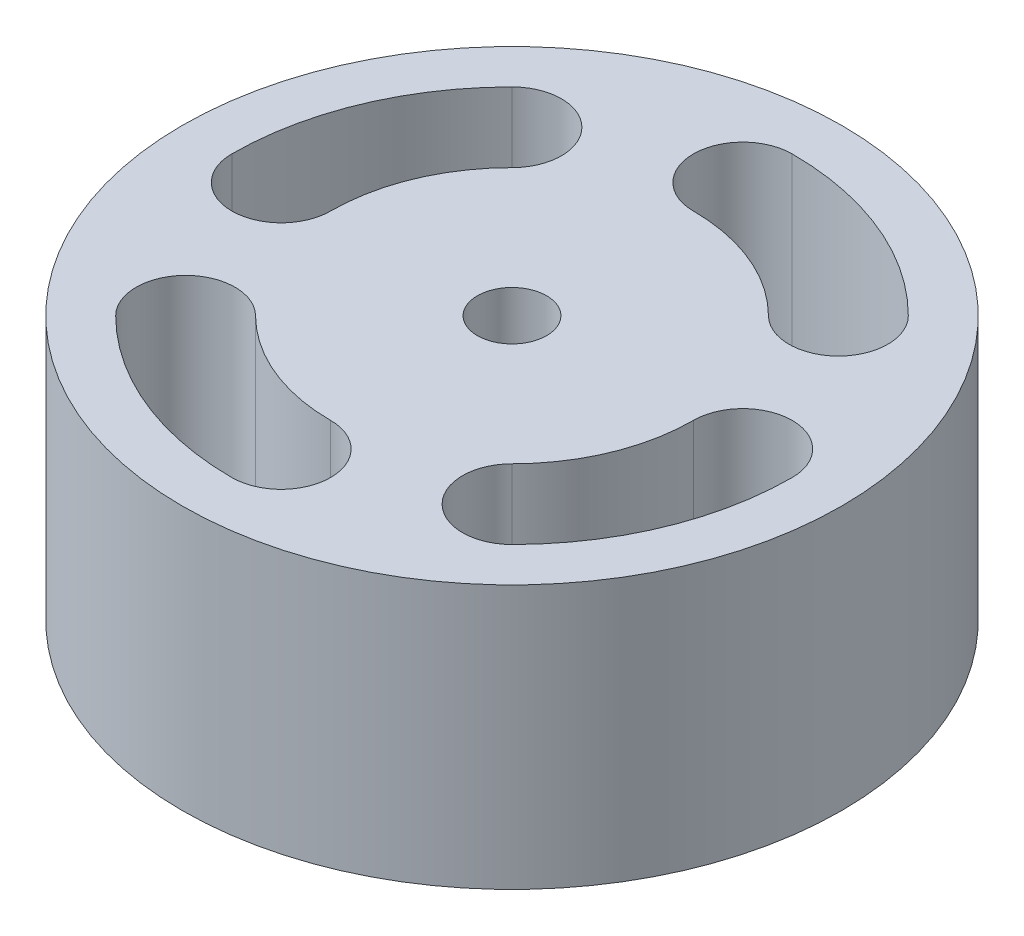
from build123d import *

# Parameters (mm, degrees)
SKETCH_1_R          = 50
EXTRUDE_1_DEPTH     = 20
SKETCH_2_R          = 5.25
CUT_EXTRUDE_1_DEPTH = 20
CUT_EXTRUDE_2_DEPTH = 20
SKETCH_4_R          = 50
SKETCH_4_R_2        = 5.25
EXTRUDE_2_DEPTH     = 20


with BuildPart() as part:
    # 草图1 → 凸台-拉伸1 (new body)
    with BuildSketch(Plane(origin=(0, 0, 0), x_dir=(1, 0, 0), z_dir=(0, 1, 0))):
        with Locations(Location((0, 0, 0), (0, 0, 270))):
            Circle(SKETCH_1_R)
    extrude(amount=EXTRUDE_1_DEPTH)

    # 草图2 → 切除-拉伸1 (cut)
    with BuildSketch(Plane(origin=(0, 20, 0), x_dir=(1, 0, 0), z_dir=(0, 1, 0))):
        with Locations(Location((0, 0, 0), (0, 0, 270))):
            Circle(SKETCH_2_R)
    extrude(amount=-CUT_EXTRUDE_1_DEPTH, mode=Mode.SUBTRACT)

    # 草图3 → 切除-拉伸2 (cut)
    with BuildSketch(Plane(origin=(0, 20, 0), x_dir=(1, 0, 0), z_dir=(0, 1, 0))):
        with BuildLine():
            ThreePointArc((42.5, 0), (35, 7.5), (27.5, 0))
            ThreePointArc((27.5, 0), (25.406687144, -10.52379439), (19.445436483, -19.445436483))
            ThreePointArc((19.445436483, -19.445436483), (19.445436477, -30.052038195), (30.052038189, -30.052038212))
            ThreePointArc((30.052038189, -30.052038212), (39.264880129, -16.264045883), (42.5, 0))
        make_face()
        with BuildLine():
            ThreePointArc((2e-09, 27.5), (10.523794391, 25.406687144), (19.445436483, 19.445436483))
            ThreePointArc((19.445436483, 19.445436483), (30.0520382, 19.445436483), (30.0520382, 30.0520382))
            ThreePointArc((30.0520382, 30.0520382), (16.264045902, 39.264880121), (5.8e-08, 42.5))
            ThreePointArc((5.8e-08, 42.5), (-7.5, 35.000000028), (2e-09, 27.5))
        make_face()
        with BuildLine():
            ThreePointArc((-30.0520382, -30.0520382), (-16.264045799, -39.264880163), (1.65e-07, -42.5))
            ThreePointArc((1.65e-07, -42.5), (7.5, -34.999999948), (6.1e-08, -27.5))
            ThreePointArc((6.1e-08, -27.5), (-10.523794348, -25.406687162), (-19.44543646, -19.445436505))
            ThreePointArc((-19.44543646, -19.445436505), (-30.052038189, -19.445436472), (-30.0520382, -30.0520382))
        make_face()
        with BuildLine():
            ThreePointArc((-27.5, 0), (-25.406687154, 10.523794365), (-19.445436521, 19.445436445))
            ThreePointArc((-19.445436521, 19.445436445), (-19.445436492, 30.05203821), (-30.052038258, 30.052038143))
            ThreePointArc((-30.052038258, 30.052038143), (-39.264880164, 16.264045797), (-42.5, -8.9e-08))
            ThreePointArc((-42.5, -8.9e-08), (-34.999999956, -7.5), (-27.5, 0))
        make_face()
    extrude(amount=-CUT_EXTRUDE_2_DEPTH, mode=Mode.SUBTRACT)

    # 草图4 → 凸台-拉伸2 (add)
    # profile 1 of 6: a face of its own
    with BuildSketch(Plane.XZ):
        with Locations(Location((0, 0, 0), (0, 0, 270))):
            Circle(SKETCH_4_R)
        with BuildLine():
            ThreePointArc((30.0520382, 30.0520382), (39.264880132, 16.264045876), (42.5, 0))
            ThreePointArc((42.5, 0), (39.264880132, -16.264045876), (30.0520382, -30.0520382))
            ThreePointArc((30.0520382, -30.0520382), (16.264045876, -39.264880132), (0, -42.5))
            ThreePointArc((0, -42.5), (-16.264045876, -39.264880132), (-30.0520382, -30.0520382))
            ThreePointArc((-30.0520382, -30.0520382), (-39.264880132, -16.264045876), (-42.5, 0))
            ThreePointArc((-42.5, 0), (-39.264880132, 16.264045876), (-30.0520382, 30.0520382))
            ThreePointArc((-30.0520382, 30.0520382), (-16.264045876, 39.264880132), (0, 42.5))
            ThreePointArc((0, 42.5), (16.264045876, 39.264880132), (30.0520382, 30.0520382))
        make_face(mode=Mode.SUBTRACT)
    # profile 2 of 6: a face of its own
    with BuildSketch(Plane.XZ):
        with BuildLine():
            ThreePointArc((0, -42.5), (-7.5, -35), (0, -27.5))
            ThreePointArc((0, -27.5), (-10.52379439, -25.406687144), (-19.445436483, -19.445436483))
            ThreePointArc((-19.445436483, -19.445436483), (-19.445436483, -30.0520382), (-30.0520382, -30.0520382))
            ThreePointArc((-30.0520382, -30.0520382), (-16.264045876, -39.264880132), (0, -42.5))
        make_face()
    # profile 3 of 6: a face of its own
    with BuildSketch(Plane.XZ):
        with BuildLine():
            ThreePointArc((-27.5, 0), (-25.406687144, 10.52379439), (-19.445436483, 19.445436483))
            ThreePointArc((-19.445436483, 19.445436483), (-30.0520382, 19.445436483), (-30.0520382, 30.0520382))
            ThreePointArc((-30.0520382, 30.0520382), (-39.264880132, 16.264045876), (-42.5, 0))
            ThreePointArc((-42.5, 0), (-35, 7.5), (-27.5, 0))
        make_face()
    # profile 4 of 6: a face of its own
    with BuildSketch(Plane.XZ):
        with BuildLine():
            ThreePointArc((0, 27.5), (10.52379439, 25.406687144), (19.445436483, 19.445436483))
            ThreePointArc((19.445436483, 19.445436483), (19.445436483, 30.0520382), (30.0520382, 30.0520382))
            ThreePointArc((30.0520382, 30.0520382), (16.264045876, 39.264880132), (0, 42.5))
            ThreePointArc((0, 42.5), (7.5, 35), (0, 27.5))
        make_face()
    # profile 5 of 6: a face of its own
    with BuildSketch(Plane.XZ):
        with BuildLine():
            ThreePointArc((19.445436483, -19.445436483), (25.406687144, -10.52379439), (27.5, 0))
            ThreePointArc((27.5, 0), (25.406687144, 10.52379439), (19.445436483, 19.445436483))
            ThreePointArc((19.445436483, 19.445436483), (10.52379439, 25.406687144), (0, 27.5))
            ThreePointArc((0, 27.5), (-10.52379439, 25.406687144), (-19.445436483, 19.445436483))
            ThreePointArc((-19.445436483, 19.445436483), (-25.406687144, 10.52379439), (-27.5, 0))
            ThreePointArc((-27.5, 0), (-25.406687144, -10.52379439), (-19.445436483, -19.445436483))
            ThreePointArc((-19.445436483, -19.445436483), (-10.52379439, -25.406687144), (0, -27.5))
            ThreePointArc((0, -27.5), (10.52379439, -25.406687144), (19.445436483, -19.445436483))
        make_face()
        with Locations(Location((0, 0, 0), (0, 0, 90))):
            Circle(SKETCH_4_R_2, mode=Mode.SUBTRACT)
    # profile 6 of 6: a face of its own
    with BuildSketch(Plane.XZ):
        with BuildLine():
            ThreePointArc((42.5, 0), (35, -7.5), (27.5, 0))
            ThreePointArc((27.5, 0), (25.406687144, -10.52379439), (19.445436483, -19.445436483))
            ThreePointArc((19.445436483, -19.445436483), (30.0520382, -19.445436483), (30.0520382, -30.0520382))
            ThreePointArc((30.0520382, -30.0520382), (39.264880132, -16.264045876), (42.5, 0))
        make_face()
    extrude(amount=EXTRUDE_2_DEPTH)


solid = part.part
